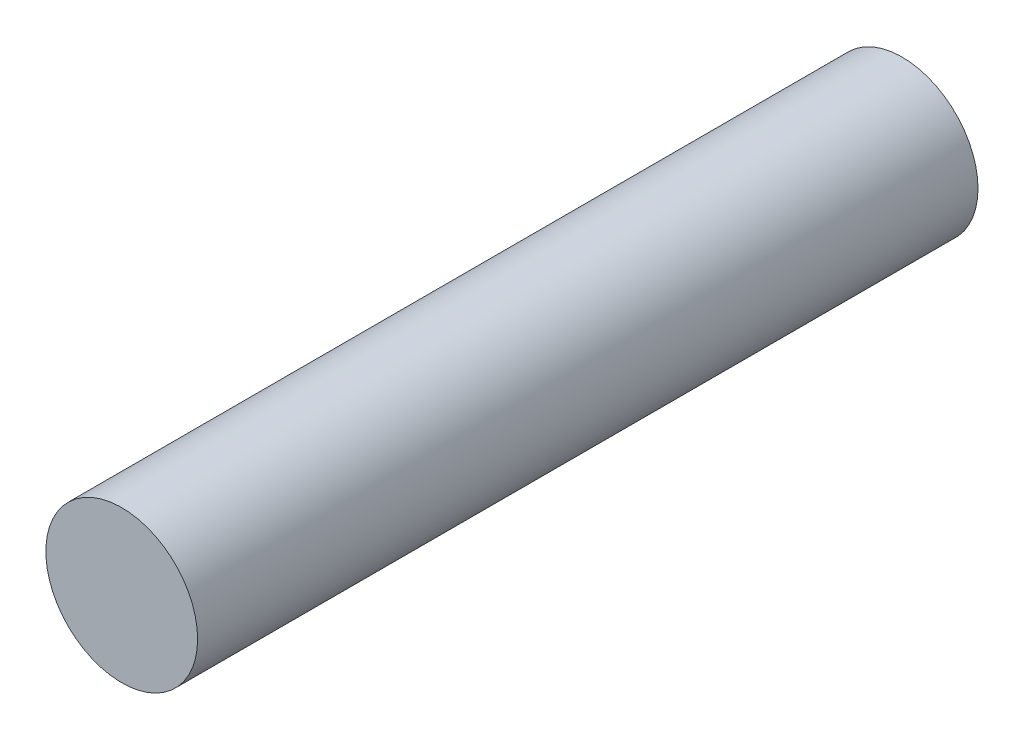
from build123d import *

# Parameters (mm, degrees)
SKETCH1_R      = 3.5
EXTRUDE1_DEPTH = 18


with BuildPart() as part:
    # Sketch1 → Extrude1 (new, symmetric)
    with BuildSketch(Plane.XY):
        Circle(SKETCH1_R)
    extrude(amount=EXTRUDE1_DEPTH, both=True)


solid = part.part
